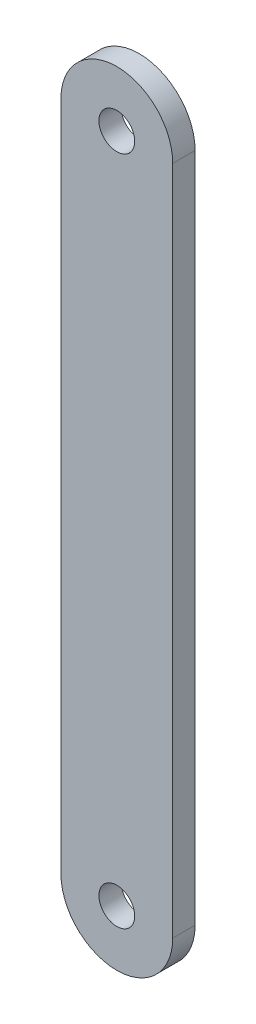
from build123d import *

# Parameters (mm, degrees)
SKETCH_1_R      = 1.6
EXTRUDE_1_DEPTH = 2


with BuildPart() as part:
    # 草图1 → 凸台-拉伸1 (new body)
    with BuildSketch(Plane.XY):
        with BuildLine():
            Line((-5, -30), (-5, 30))
            ThreePointArc((-5, 30), (0, 35), (5, 30))
            Line((5, 30), (5, -30))
            ThreePointArc((5, -30), (0, -35), (-5, -30))
        make_face()
        with Locations((0, 30)):
            Circle(SKETCH_1_R, mode=Mode.SUBTRACT)
        with Locations(Location((0, -30, 0), (0, 0, 180))):
            Circle(SKETCH_1_R, mode=Mode.SUBTRACT)
    extrude(amount=EXTRUDE_1_DEPTH)


solid = part.part
